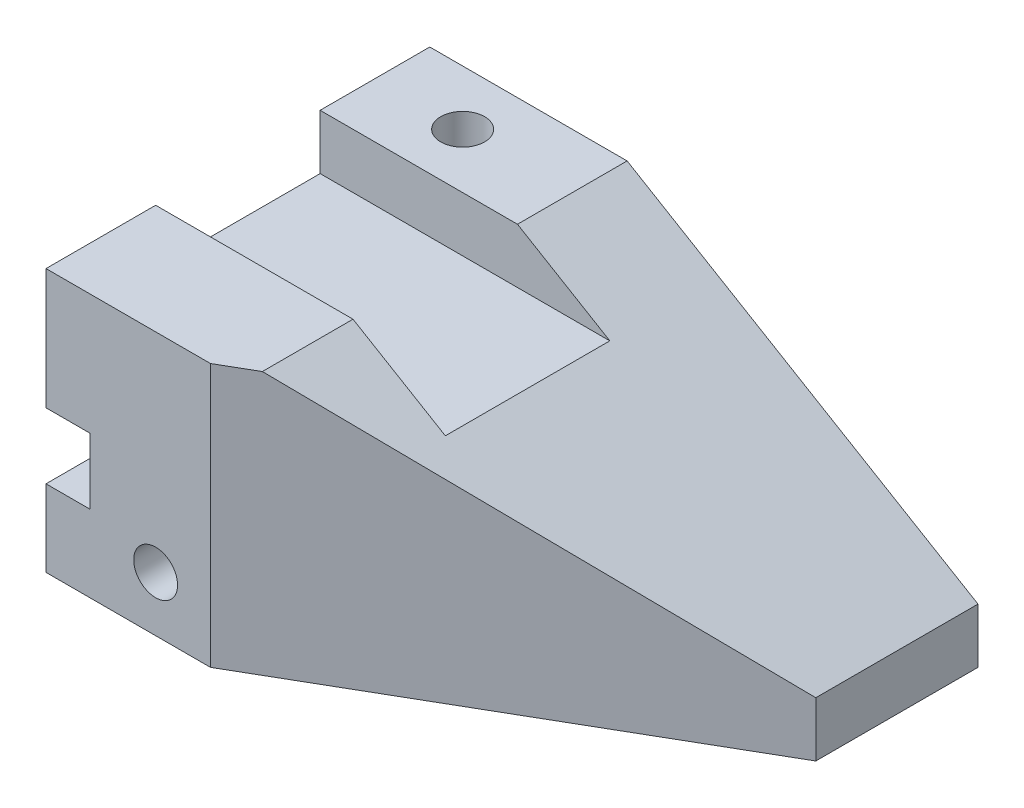
from build123d import *

# Parameters (mm, degrees)
EXTRUDE_3_DEPTH     = 175
CUT_EXTRUDE_2_DEPTH = 220
SKETCH_9_W          = 75
SKETCH_9_H          = 25
CUT_EXTRUDE_3_DEPTH = 220
SKETCH_10_W         = 20
SKETCH_10_H         = 30
CUT_EXTRUDE_4_DEPTH = 220
SKETCH_11_R         = 10
CUT_EXTRUDE_5_DEPTH = 220
SKETCH_12_R         = 10
CUT_EXTRUDE_6_DEPTH = 220


with BuildPart() as part:
    # 草图7 → 凸台-拉伸3 (new body)
    with BuildSketch(Plane.XY):
        Polygon((0, 0), (250, 0), (250, 25), (90, 120), (0, 120), align=None)
    extrude(amount=EXTRUDE_3_DEPTH)

    # 草图8 → 切除-拉伸2 (cut)
    with BuildSketch(Plane(origin=(0, 0, 0), x_dir=(1, 0, 0), z_dir=(0, 1, 0))):
        Polygon((75, -175), (250, -73.963702892), (250, -175), align=None)
    extrude(amount=CUT_EXTRUDE_2_DEPTH, mode=Mode.SUBTRACT)

    # 草图9 → 切除-拉伸3 (cut)
    with BuildSketch(Plane.ZY):
        with Locations((87.5, 107.5)):
            Rectangle(SKETCH_9_W, SKETCH_9_H)
    extrude(amount=-CUT_EXTRUDE_3_DEPTH, mode=Mode.SUBTRACT)

    # 草图10 → 切除-拉伸4 (cut)
    with BuildSketch(Plane.XY.offset(175)):
        with Locations((10, 50)):
            Rectangle(SKETCH_10_W, SKETCH_10_H)
    extrude(amount=-CUT_EXTRUDE_4_DEPTH, mode=Mode.SUBTRACT)

    # 草图11 → 切除-拉伸5 (cut)
    with BuildSketch(Plane.XY.offset(175)):
        with Locations((50, 25)):
            Circle(SKETCH_11_R)
    extrude(amount=-CUT_EXTRUDE_5_DEPTH, mode=Mode.SUBTRACT)

    # 草图12 → 切除-拉伸6 (cut)
    with BuildSketch(Plane(origin=(0, 120, 0), x_dir=(1, 0, 0), z_dir=(0, 1, 0))):
        with Locations(Location((40, -25, 0), (0, 0, 180))):
            Circle(SKETCH_12_R)
    extrude(amount=-CUT_EXTRUDE_6_DEPTH, mode=Mode.SUBTRACT)


solid = part.part
